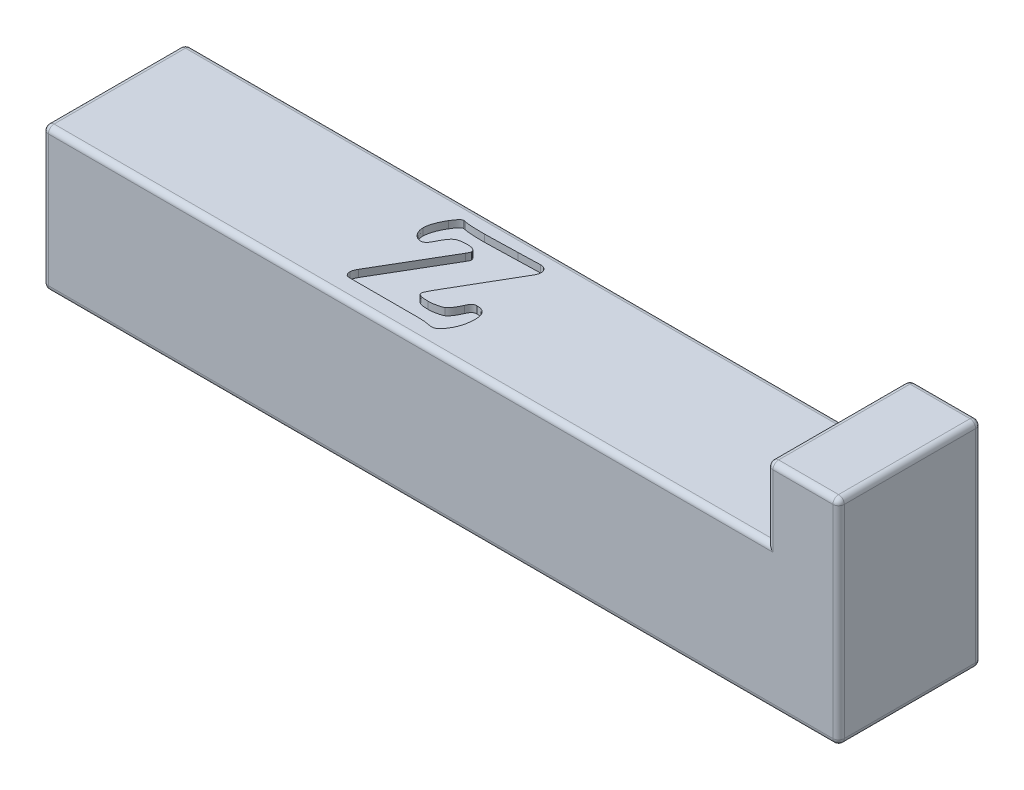
from build123d import *

# Parameters (mm, degrees)
SKETCH1_W           = 101.5
SKETCH1_H           = 20
BOSS_EXTRUDE1_DEPTH = 20
SKETCH2_W           = 20
SKETCH2_H           = 30
BOSS_EXTRUDE2_DEPTH = 10
CUT_EXTRUDE1_DEPTH  = 1
FILLET1_R           = 0.8


with BuildPart() as part:
    # Sketch1 → Boss-Extrude1 (new body)
    with BuildSketch(Plane(origin=(0, 0, 0), x_dir=(1, 0, 0), z_dir=(0, 1, 0))):
        with Locations((50.75, -10)):
            Rectangle(SKETCH1_W, SKETCH1_H)
    extrude(amount=BOSS_EXTRUDE1_DEPTH)

    # Sketch2 → Boss-Extrude2 (add)
    with BuildSketch(Plane(origin=(101.5, 0, 0), x_dir=(0, 0, -1), z_dir=(1, 0, 0))):
        with Locations((-10, 15)):
            Rectangle(SKETCH2_W, SKETCH2_H)
    extrude(amount=BOSS_EXTRUDE2_DEPTH)

    # Sketch3 → Cut-Extrude1 (cut)
    with BuildSketch(Plane(origin=(0, 20, 0), x_dir=(1, 0, 0), z_dir=(0, 1, 0))):
        with BuildLine():
            Line((52.581358314, -4.140201821), (47.824891887, -12.32708949))
            add(Edge.make_bspline(
                [(47.824891887, -12.32708949), (47.762130595, -12.438251543), (47.643899437, -12.647661161), (47.473595199, -12.941280829), (47.338398262, -13.205416604), (47.220446869, -13.430521279), (47.13452292, -13.624275978), (47.069704136, -13.780363588), (47.0262686, -13.901867253), (47.017923346, -13.973246381), (47.01453094, -14.002262515)],
                knots=[0, 0, 0, 0, 1.639887509, 3.089257623, 4.359123962, 5.450899735, 6.35327128, 7.079123407, 7.625656983, 8, 8, 8, 8], degree=3))
            add(Edge.make_bspline(
                [(47.01453094, -14.002262515), (47.018492056, -14.042004169), (47.026558902, -14.122938379), (47.108970112, -14.225915884), (47.224818356, -14.315455484), (47.391308286, -14.377631523), (47.597898792, -14.432806629), (47.850786588, -14.466866191), (48.147771227, -14.494745683), (48.360767185, -14.495253243), (48.475102449, -14.4955257)],
                knots=[0, 0, 0, 0, 0.565727151, 1.152108034, 1.83398836, 2.670541227, 3.692023135, 4.924634963, 6.349157997, 8, 8, 8, 8], degree=3))
            add(Edge.make_bspline(
                [(48.475102449, -14.4955257), (48.664485355, -14.489293487), (49.047753116, -14.476680913), (49.517332049, -14.393236387), (49.874004365, -14.30633681), (50.103551797, -14.232550163), (50.29826258, -14.158668017), (50.407233925, -14.093389482), (50.457764213, -14.063119661)],
                knots=[0, 0, 0, 0, 1.662759855, 3.36504629, 4.177143473, 4.886062057, 5.483464168, 6, 6, 6, 6], degree=3))
            add(Edge.make_bspline(
                [(50.457764213, -14.063119661), (50.503293298, -14.027626787), (50.599466789, -13.952653314), (50.736201743, -13.817788663), (50.871658624, -13.655379469), (51.003933729, -13.466329633), (51.1400035, -13.253410533), (51.274629663, -13.013249358), (51.403232125, -12.743673982), (51.489392639, -12.555684484), (51.533974798, -12.458412806)],
                knots=[0, 0, 0, 0, 0.708968974, 1.497592602, 2.354323444, 3.304509276, 4.330897156, 5.458688189, 6.685045352, 8, 8, 8, 8], degree=3))
            add(Edge.make_bspline(
                [(51.533974798, -12.458412806), (51.567927113, -12.384083986), (51.631116658, -12.245748667), (51.737289282, -12.06326596), (51.838079211, -11.91550276), (51.945223215, -11.804118964), (52.060064876, -11.719458228), (52.192580328, -11.666707937), (52.338962188, -11.628346872), (52.443339555, -11.6265652), (52.498080114, -11.625630805)],
                knots=[0, 0, 0, 0, 1.431567363, 2.664327634, 3.697832601, 4.558199324, 5.363243514, 6.176729048, 7.043788176, 8, 8, 8, 8], degree=3))
            add(Edge.make_bspline(
                [(52.498080114, -11.625630805), (52.614893655, -11.631169356), (52.836626389, -11.641682505), (53.148564259, -11.720042325), (53.413157981, -11.861492966), (53.630060013, -12.05845031), (53.796531077, -12.311131023), (53.91430788, -12.615390121), (53.98367834, -12.972070078), (53.99035179, -13.226804705), (53.993884708, -13.361660976)],
                knots=[0, 0, 0, 0, 1.070146798, 2.031327657, 2.92000091, 3.792748875, 4.688290372, 5.66762694, 6.765243907, 8, 8, 8, 8], degree=3))
            add(Edge.make_bspline(
                [(53.993884708, -13.361660976), (53.992057656, -13.506995855), (53.988448113, -13.794120908), (53.940775099, -14.216640436), (53.870872224, -14.624274435), (53.776185741, -15.018376033), (53.645735647, -15.396165487), (53.493239147, -15.762353415), (53.310215187, -16.114110536), (53.166162272, -16.335172002), (53.093839546, -16.446157386)],
                knots=[0, 0, 0, 0, 1.068555062, 2.111048158, 3.123313267, 4.109998825, 5.08852411, 6.05996404, 7.025992006, 8, 8, 8, 8], degree=3))
            add(Edge.make_bspline(
                [(53.093839546, -16.446157386), (53.042398437, -16.518349476), (52.943427831, -16.657244128), (52.788063081, -16.845346134), (52.633866803, -17.004225055), (52.481926321, -17.132700902), (52.335810379, -17.239578213), (52.185930567, -17.308455002), (52.040158939, -17.359423941), (51.941163619, -17.363450063), (51.89271166, -17.365420595)],
                knots=[0, 0, 0, 0, 1.35702508, 2.610861191, 3.732254801, 4.74123757, 5.657338001, 6.490951881, 7.26141622, 8, 8, 8, 8], degree=3))
            add(Edge.make_bspline(
                [(51.89271166, -17.365420595), (51.82962941, -17.362043481), (51.685833487, -17.354345356), (51.543436864, -17.332718048), (51.463508629, -17.320578487)],
                knots=[0, 0, 0, 0, 0.877385801, 2, 2, 2, 2], degree=3))
            add(Edge.make_bspline(
                [(51.463508629, -17.320578487), (51.210141427, -17.273065157), (50.720955928, -17.1813294), (50.223516355, -17.167226561), (49.983719074, -17.160428102)],
                knots=[0, 0, 0, 0, 1.035873722, 2, 2, 2, 2], degree=3))
            Line((49.983719074, -17.160428102), (40.662966681, -17.160428102))
            add(Edge.make_bspline(
                [(40.662966681, -17.160428102), (40.567942778, -17.161211167), (40.399217719, -17.162601583), (40.177082449, -17.154680511), (40.01914097, -17.149276525), (39.890670249, -17.1414864), (39.767563407, -17.091297703), (39.694606563, -17.02458131), (39.654019257, -16.987465687)],
                knots=[0, 0, 0, 0, 1.621611215, 2.879343431, 3.79108949, 4.322299433, 5.066662645, 6, 6, 6, 6], degree=3))
            add(Edge.make_bspline(
                [(39.654019257, -16.987465687), (39.621040738, -16.948194746), (39.553802437, -16.868127132), (39.489392144, -16.720801829), (39.444743698, -16.557697767), (39.441241575, -16.442230328), (39.439417741, -16.382097232)],
                knots=[0, 0, 0, 0, 0.931508936, 1.899208308, 2.90595036, 4, 4, 4, 4], degree=3))
            add(Edge.make_bspline(
                [(39.439417741, -16.382097232), (39.443545965, -16.319779337), (39.452381089, -16.186408108), (39.517180976, -15.979791336), (39.609496735, -15.750606697), (39.694860063, -15.596484957), (39.740500464, -15.514082147)],
                knots=[0, 0, 0, 0, 0.805363313, 1.723618771, 2.782908824, 4, 4, 4, 4], degree=3))
            Line((39.740500464, -15.514082147), (45.284906785, -6.062006438))
            add(Edge.make_bspline(
                [(45.284906785, -6.062006438), (45.321823822, -5.997191886), (45.388765833, -5.879663048), (45.469997061, -5.718677556), (45.520158981, -5.588571658), (45.530444127, -5.51133108), (45.534741385, -5.479059038)],
                knots=[0, 0, 0, 0, 1.400727278, 2.539951972, 3.38997438, 4, 4, 4, 4], degree=3))
            add(Edge.make_bspline(
                [(45.534741385, -5.479059038), (45.531449993, -5.430303752), (45.525044457, -5.335418737), (45.461799192, -5.204048171), (45.362934625, -5.092105939), (45.220995586, -5.005011976), (45.043253746, -4.940404697), (44.827898381, -4.893032384), (44.575609749, -4.865654755), (44.394541594, -4.862535251), (44.298380415, -4.860878553)],
                knots=[0, 0, 0, 0, 0.757044826, 1.473321461, 2.229447431, 3.062061489, 4.043802376, 5.172461367, 6.498358542, 8, 8, 8, 8], degree=3))
            add(Edge.make_bspline(
                [(44.298380415, -4.860878553), (44.133760748, -4.864927324), (43.826575269, -4.872482458), (43.401372552, -4.932870722), (43.046965983, -5.039513577), (42.799635286, -5.172189201), (42.634695793, -5.3129621), (42.510008065, -5.441335571), (42.383406178, -5.599184065), (42.251223475, -5.782642953), (42.118031443, -5.994214209), (41.980193504, -6.23300563), (41.835487846, -6.498168285), (41.742709976, -6.687281604), (41.694335158, -6.785886177)],
                knots=[0, 0, 0, 0, 1.684686315, 3.143677692, 4.381032218, 5.457338824, 5.984845669, 6.59536163, 7.286610468, 8.05392531, 8.908846043, 9.844152544, 10.875930996, 12, 12, 12, 12], degree=3))
            add(Edge.make_bspline(
                [(41.694335158, -6.785886177), (41.658328213, -6.860303647), (41.589515332, -7.002522887), (41.469769234, -7.194190318), (41.350303878, -7.360615341), (41.219411378, -7.492405016), (41.08969551, -7.600706091), (40.953071838, -7.676707989), (40.810759416, -7.720156294), (40.714492477, -7.727225129), (40.666169688, -7.730773447)],
                knots=[0, 0, 0, 0, 1.347145644, 2.574530311, 3.681932705, 4.679286651, 5.595688759, 6.429462517, 7.211642642, 8, 8, 8, 8], degree=3))
            add(Edge.make_bspline(
                [(40.666169688, -7.730773447), (40.574417123, -7.72508807), (40.389297817, -7.713617294), (40.125018801, -7.602914565), (39.879224736, -7.429942619), (39.657354859, -7.198986851), (39.470826566, -6.924776548), (39.335530968, -6.62202517), (39.246434258, -6.29981032), (39.238478381, -6.07648606), (39.234425249, -5.9627132)],
                knots=[0, 0, 0, 0, 0.876014372, 1.767440193, 2.701562725, 3.743872462, 4.819813707, 5.864282218, 6.911955548, 8, 8, 8, 8], degree=3))
            add(Edge.make_bspline(
                [(39.234425249, -5.9627132), (39.236532883, -5.867508054), (39.240888842, -5.670742556), (39.290458933, -5.370259679), (39.359827057, -5.055194551), (39.460573185, -4.727927746), (39.590137512, -4.387234441), (39.74721752, -4.032241329), (39.933927222, -3.662731295), (40.074642036, -3.415716706), (40.147282442, -3.288201774)],
                knots=[0, 0, 0, 0, 0.798977698, 1.65128936, 2.552049175, 3.508122468, 4.524187068, 5.612339841, 6.767431826, 8, 8, 8, 8], degree=3))
            add(Edge.make_bspline(
                [(40.147282442, -3.288201774), (40.198707138, -3.202226063), (40.295895638, -3.039738951), (40.447303363, -2.817793841), (40.590044113, -2.629130108), (40.723934592, -2.474074163), (40.849793571, -2.352660149), (40.967704341, -2.264189565), (41.080977323, -2.20695097), (41.15680841, -2.199418474), (41.19146295, -2.19597615)],
                knots=[0, 0, 0, 0, 1.545153613, 2.920214852, 4.14236272, 5.192862881, 6.078293574, 6.832705235, 7.466550398, 8, 8, 8, 8], degree=3))
            add(Edge.make_bspline(
                [(41.19146295, -2.19597615), (41.231134003, -2.198062643), (41.325517061, -2.203026704), (41.417059352, -2.226950249), (41.47012462, -2.240818258)],
                knots=[0, 0, 0, 0, 0.840639281, 2, 2, 2, 2], degree=3))
            add(Edge.make_bspline(
                [(41.47012462, -2.240818258), (41.531893685, -2.254489003), (41.670505193, -2.285166536), (41.906243552, -2.314774974), (42.190536419, -2.339123753), (42.522687157, -2.361023594), (42.902756173, -2.380836946), (43.332067506, -2.392983839), (43.810441032, -2.398424133), (44.145702587, -2.40009565), (44.320801469, -2.400968643)],
                knots=[0, 0, 0, 0, 0.530760142, 1.19104058, 1.991807215, 2.925885713, 3.984679096, 5.186021245, 6.530327963, 8, 8, 8, 8], degree=3))
            add(Edge.make_bspline(
                [(44.320801469, -2.400968643), (44.416890199, -2.399781894), (44.634688492, -2.397091966), (45.002022224, -2.395650822), (45.448270092, -2.384116062), (45.974639267, -2.371848178), (46.579995684, -2.355289957), (47.265511321, -2.337309283), (48.030892673, -2.309409952), (48.567978105, -2.293834673), (48.84985435, -2.285660366)],
                knots=[0, 0, 0, 0, 0.509046604, 1.153823976, 1.945807145, 2.873621773, 3.942927651, 5.153728267, 6.506203407, 8, 8, 8, 8], degree=3))
            add(Edge.make_bspline(
                [(48.84985435, -2.285660366), (49.085795383, -2.277704395), (49.526683573, -2.262837573), (50.141788803, -2.249149134), (50.664874554, -2.231670468), (51.096236125, -2.219695677), (51.436777396, -2.208389932), (51.68567119, -2.205438497), (51.84247368, -2.195321465), (51.916197246, -2.195829097), (51.937553768, -2.19597615)],
                knots=[0, 0, 0, 0, 1.834144183, 3.427350044, 4.780093017, 5.900427687, 6.78006407, 7.427297254, 7.834097302, 8, 8, 8, 8], degree=3))
            add(Edge.make_bspline(
                [(51.937553768, -2.19597615), (52.011617505, -2.198314224), (52.153195746, -2.202783623), (52.353588588, -2.257329293), (52.533838948, -2.33980611), (52.687173089, -2.45995728), (52.814297429, -2.604547339), (52.906489867, -2.774945616), (52.957068734, -2.968278697), (52.964885628, -3.103213572), (52.968922246, -3.172893497)],
                knots=[0, 0, 0, 0, 1.109779201, 2.121423945, 3.097333964, 4.069545339, 5.024800955, 5.972212063, 6.952856983, 8, 8, 8, 8], degree=3))
            add(Edge.make_bspline(
                [(52.968922246, -3.172893497), (52.962172062, -3.229861458), (52.946421244, -3.362790003), (52.868563163, -3.581959668), (52.744900228, -3.847206205), (52.639365548, -4.036278216), (52.581358314, -4.140201821)],
                knots=[0, 0, 0, 0, 0.654122653, 1.526324136, 2.640341775, 4, 4, 4, 4], degree=3))
        make_face()
    extrude(amount=-CUT_EXTRUDE1_DEPTH, mode=Mode.SUBTRACT)

    # Fillet1
    fillet1_edges = [part.edges().sort_by_distance(p)[0] for p in [
        (101.5, 25, 20),
        (106.5, 30, 20),
        (101.5, 25, 0),
        (101.5, 30, 10),
        (106.5, 30, 0),
        (111.5, 15, 20),
        (111.5, 0, 10),
        (50.75, 20, 0),
        (111.5, 15, 0),
        (111.5, 30, 10),
        (0, 20, 10),
        (55.75, 0, 0),
        (55.75, 0, 20),
        (0, 0, 10),
        (0, 10, 0),
        (0, 10, 20),
        (50.75, 20, 20),
    ]]
    fillet(fillet1_edges, radius=FILLET1_R)


solid = part.part
